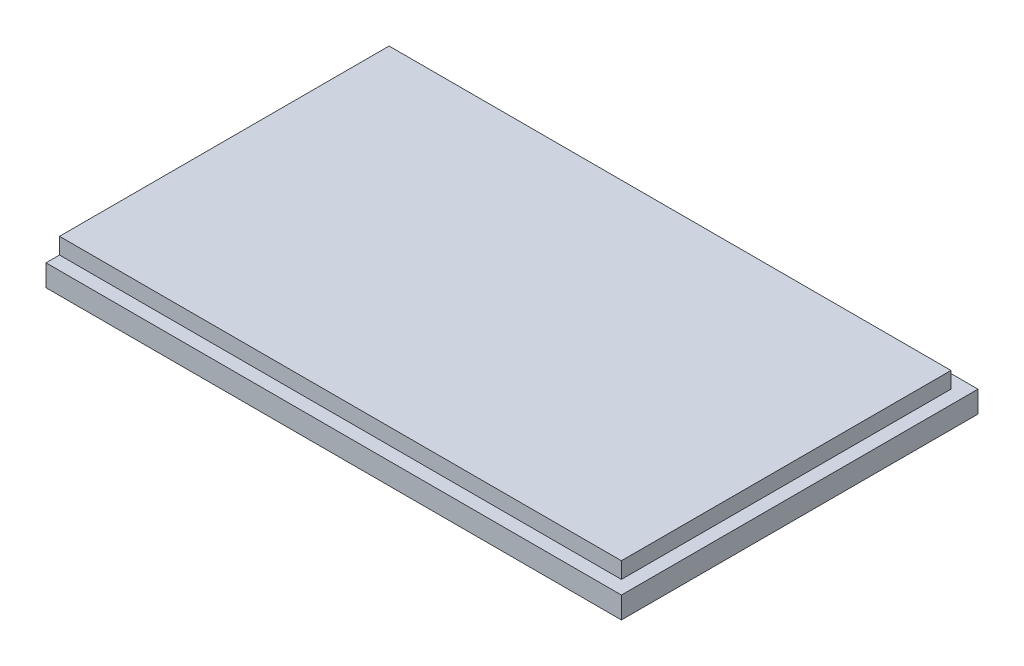
from build123d import *

# Parameters (mm, degrees)
SKETCH_2_W      = 42.6
SKETCH_2_H      = 26.4
EXTRUDE_1_DEPTH = 1.6
SKETCH_3_W      = 41.6
SKETCH_3_H      = 24.4
EXTRUDE_2_DEPTH = 1.2


with BuildPart() as part:
    # 草图2 → 凸台-拉伸1 (new body)
    with BuildSketch(Plane(origin=(0, 0, 0), x_dir=(1, 0, 0), z_dir=(0, 1, 0))):
        Rectangle(SKETCH_2_W, SKETCH_2_H)
    extrude(amount=EXTRUDE_1_DEPTH)

    # 草图3 → 凸台-拉伸2 (add)
    with BuildSketch(Plane(origin=(0, 1.6, 0), x_dir=(1, 0, 0), z_dir=(0, 1, 0))):
        with Locations((-0.5, 0)):
            Rectangle(SKETCH_3_W, SKETCH_3_H)
    extrude(amount=EXTRUDE_2_DEPTH)


solid = part.part
